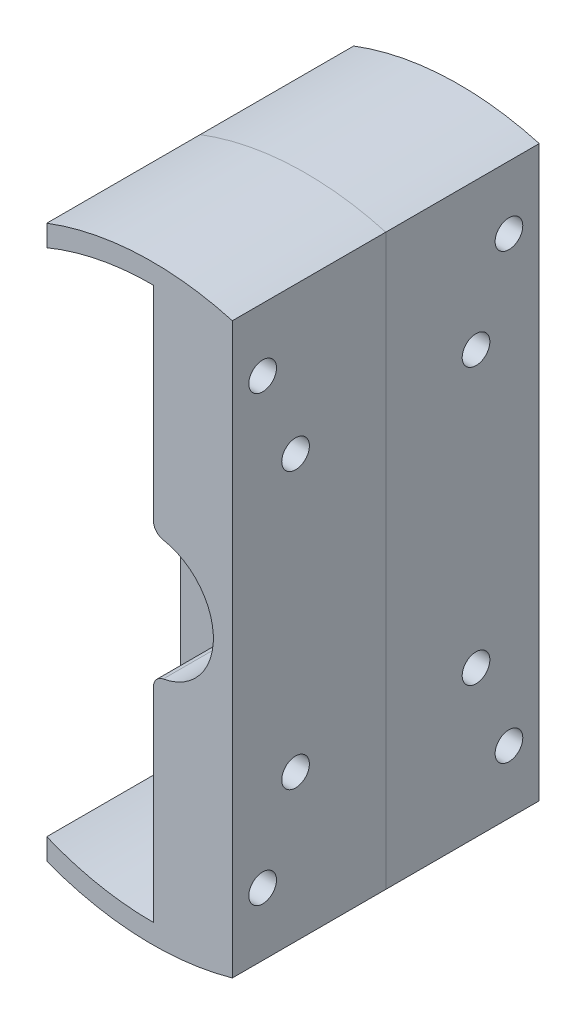
from build123d import *

# Parameters (mm, degrees)
EXTRUDE_1_DEPTH     = 20.3
SKETCH_5_R          = 2.1
CUT_EXTRUDE_1_DEPTH = 52.87041546
EXTRUDE_2_DEPTH     = 3


with BuildPart() as part:
    # 草图2 → 凸台-拉伸1 (new body)
    with BuildSketch(Plane(origin=(0, 0, 0), x_dir=(-1, 0, 0), z_dir=(0, 0, 1))):
        with BuildLine():
            Line((-0.2, 41.5), (-0.2, 10.918333206))
            ThreePointArc((-0.2, 10.918333206), (-0.617288211, 9.765897478), (-1.675675676, 9.147792686))
            ThreePointArc((-1.675675676, 9.147792686), (-9.3, 0), (-1.675675676, -9.147792686))
            ThreePointArc((-1.675675676, -9.147792686), (-0.617288211, -9.765897478), (-0.2, -10.918333206))
            Line((-0.2, -10.918333206), (-0.2, -41.5))
            Line((-0.2, -41.5), (-0.2, -41.89952267))
            ThreePointArc((-0.2, -41.89952267), (8.057897913, -41.117882742), (16, -38.724798256))
            Line((16, -38.724798256), (16, -41.952473109))
            ThreePointArc((16, -41.952473109), (2.011178974, -44.854934613), (-12.18126433, -43.216047937))
            Line((-12.18126433, -43.216047937), (-12.18126433, 43.216047937))
            ThreePointArc((-12.18126433, 43.216047937), (2.011178974, 44.854934613), (16, 41.952473109))
            Line((16, 41.952473109), (16, 38.724798256))
            ThreePointArc((16, 38.724798256), (8.057897913, 41.117882742), (-0.2, 41.89952267))
            Line((-0.2, 41.89952267), (-0.2, 41.5))
        make_face()
    extrude(amount=-EXTRUDE_1_DEPTH)

    # 草图5 → 切除-拉伸1 (cut, through all)
    with BuildSketch(Plane.ZY.offset(-0.2)):
        with Locations((-4.6, 33.667083302)):
            Circle(SKETCH_5_R)
        with Locations((-9.6, 20.918333206)):
            Circle(SKETCH_5_R)
        with Locations((-9.6, -20.918333206)):
            Circle(SKETCH_5_R)
        with Locations((-4.6, -33.667083302)):
            Circle(SKETCH_5_R)
    extrude(amount=-CUT_EXTRUDE_1_DEPTH, mode=Mode.SUBTRACT)

    # 草图7 → 凸台-拉伸2 (add)
    with BuildSketch(Plane(origin=(0, 0, -20.3), x_dir=(-1, 0, 0), z_dir=(0, 0, -1))):
        with BuildLine():
            Line((-12.18126433, 43.216047937), (-12.18126433, -43.216047937))
            ThreePointArc((-12.18126433, -43.216047937), (2.011178974, -44.854934613), (16, -41.952473109))
            Line((16, -41.952473109), (16, 41.952473109))
            ThreePointArc((16, 41.952473109), (2.011178974, 44.854934613), (-12.18126433, 43.216047937))
        make_face()
    extrude(amount=EXTRUDE_2_DEPTH)


with BuildPart() as body_2:
    # 镜向2: mirrored copy
    add(part.part.mirror(Plane.XY.offset(-23.3)))


solid = Compound([part.part, body_2.part])
